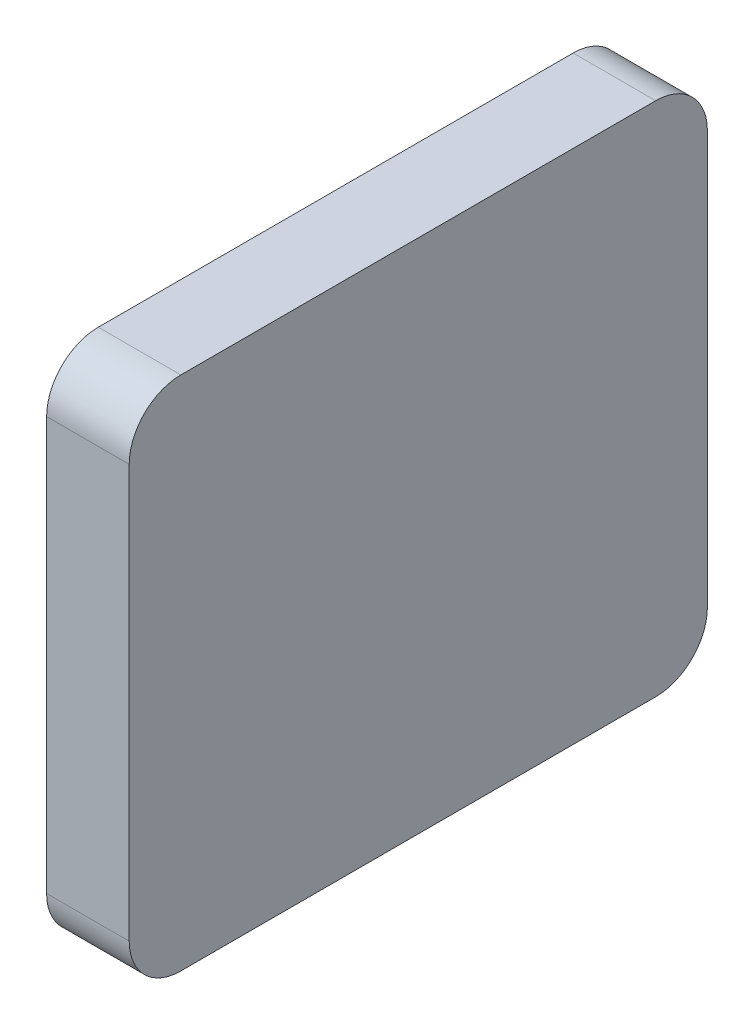
from build123d import *

# Parameters (mm, degrees)
BASES_W    = 5.6
BASES_H    = 5
BASE_DEPTH = 0.4
BASEF_R    = 0.5


with BuildPart() as part:
    # BaseS → Base (new, symmetric)
    with BuildSketch(Plane(origin=(0, 0, 0), x_dir=(0, 0, -1), z_dir=(1, 0, 0))):
        Rectangle(BASES_W, BASES_H)
    extrude(amount=BASE_DEPTH, both=True)

    # BaseF
    basef_edges = [part.edges().sort_by_distance(p)[0] for p in [
        (0, -2.5, -2.8),
        (0, -2.5, 2.8),
        (0, 2.5, 2.8),
        (0, 2.5, -2.8),
    ]]
    fillet(basef_edges, radius=BASEF_R)


solid = part.part
